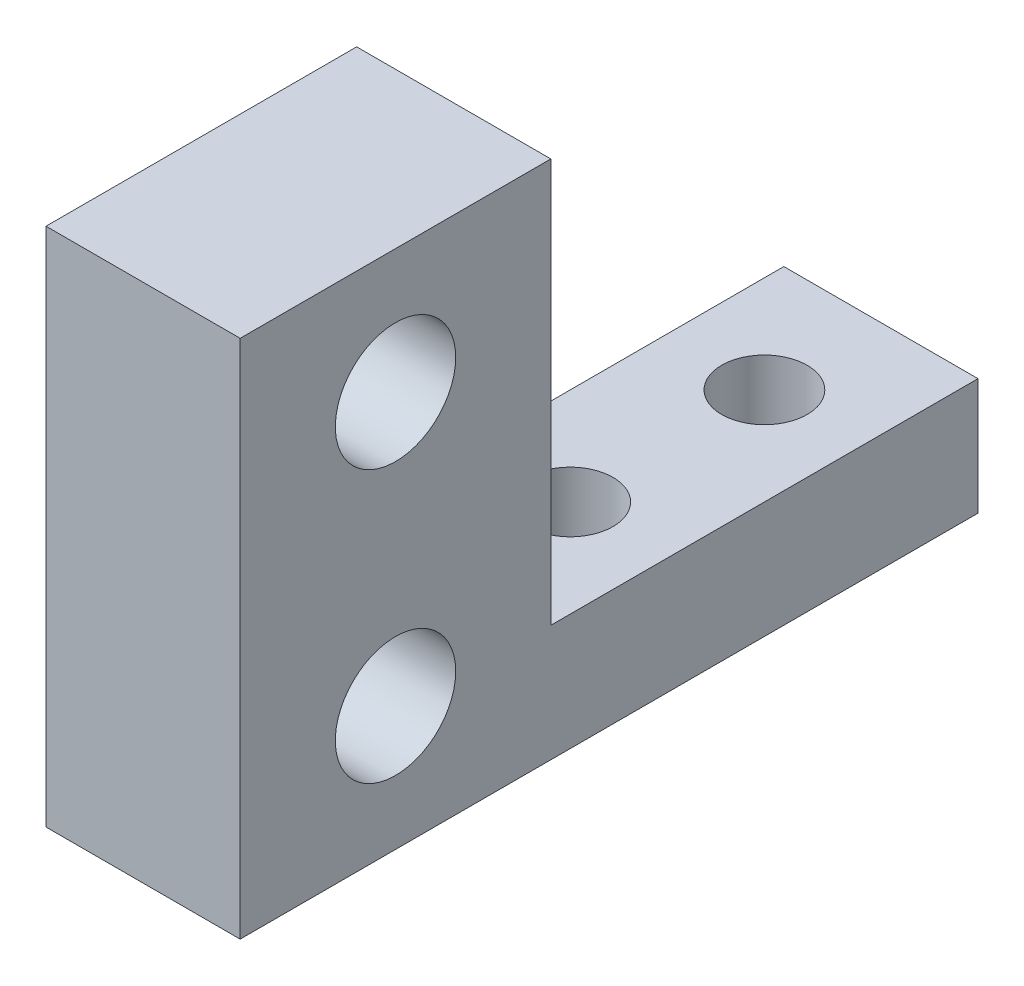
from build123d import *

# Parameters (mm, degrees)
SKETCH_1_R          = 1.55
EXTRUDE_1_DEPTH     = 5
SKETCH_2_R          = 1.1
CUT_EXTRUDE_1_DEPTH = 5


with BuildPart() as part:
    # 草图1 → 凸台-拉伸1 (new body)
    with BuildSketch(Plane(origin=(0, 0, 0), x_dir=(0, 0, -1), z_dir=(1, 0, 0))):
        Polygon((-4, 10.2), (-4, -3.2), (15, -3.2), (15, -0.2), (4, -0.2), (4, 10.2), align=None)
        Circle(SKETCH_1_R, mode=Mode.SUBTRACT)
        with Locations((0, 7)):
            Circle(SKETCH_1_R, mode=Mode.SUBTRACT)
    extrude(amount=EXTRUDE_1_DEPTH)

    # 草图2 → 切除-拉伸1 (cut)
    with BuildSketch(Plane(origin=(0, -0.2, 0), x_dir=(1, 0, 0), z_dir=(0, 1, 0))):
        with Locations(Location((2.5, 7, 0), (0, 0, 270))):
            Circle(SKETCH_2_R)
        with Locations(Location((2.5, 12, 0), (0, 0, 270))):
            Circle(SKETCH_2_R)
    extrude(amount=-CUT_EXTRUDE_1_DEPTH, mode=Mode.SUBTRACT)


solid = part.part
